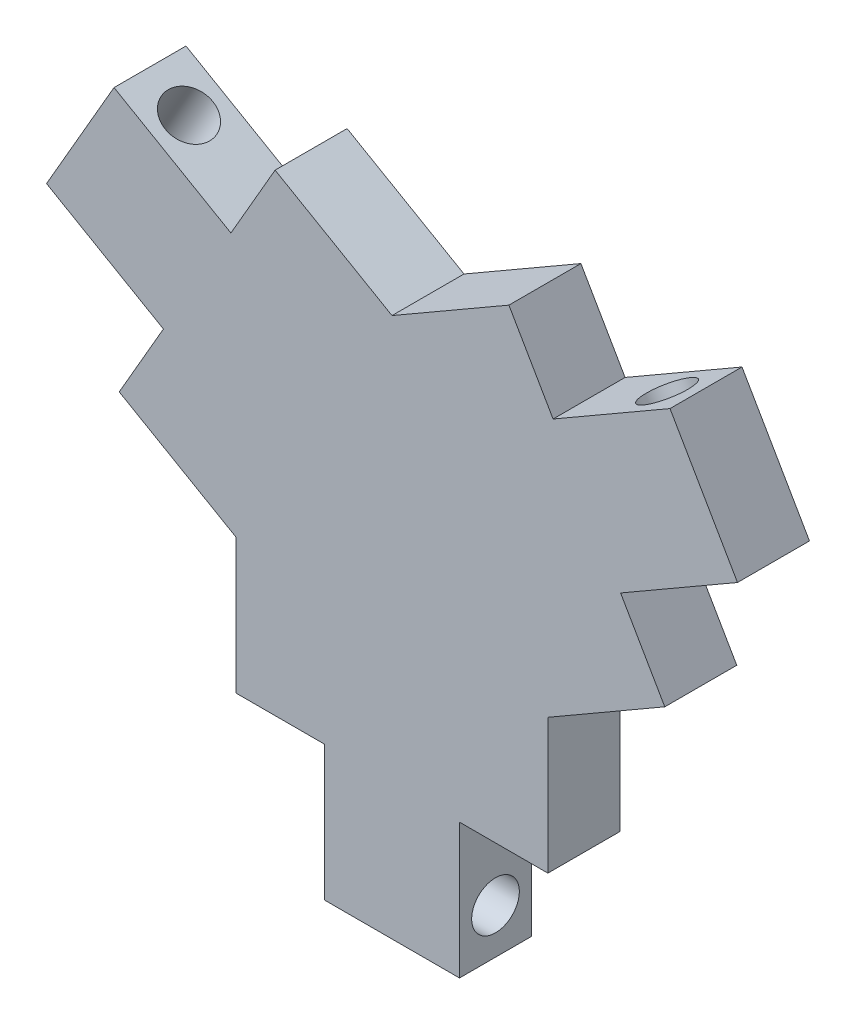
from build123d import *

# Parameters (mm, degrees)
BOSS_EXTRUDE5_DEPTH = 8
CUT_EXTRUDE4_REACH  = 91.241
SKETCH6_R           = 2.65
CUT_EXTRUDE5_REACH  = 89.972
SKETCH7_R           = 2.65
CUT_EXTRUDE6_REACH  = 74.553
SKETCH8_R           = 2.65
CUT_EXTRUDE7_REACH  = 91.241
SKETCH10_W          = 9.820508075
SKETCH10_H          = 15
SKETCH10_W_2        = 9.820508076


with BuildPart() as part:
    # Sketch1 → Boss-Extrude5 (new body)
    with BuildSketch(Plane(origin=(0, 0, 0), x_dir=(0, 1, 0), z_dir=(0, 0, 1))):
        Polygon((35, 60.621778265), (30, 51.961524227), (50, 17.320508076), (65, 43.301270189), align=None)
        Polygon((60, 0), (0, 0), (30, 51.961524227), align=None)
        Polygon((60, 0), (20, 0), (35, -25.980762114), (65, -8.660254038), align=None)
        Polygon((-10, 0), (0, 0), (20, 34.641016151), (-10, 34.641016151), align=None)
    extrude(amount=BOSS_EXTRUDE5_DEPTH)

    # Sketch6 → Cut-Extrude4 (cut, up to next)
    with BuildSketch(Plane(origin=(-34.641016151, 0, 0), x_dir=(0, -1, 0), z_dir=(-1, 0, 0)), mode=Mode.PRIVATE) as cut_extrude4_sk1:
        with Locations(Location((5, 4, 0), (0, 0, 90))):
            Circle(SKETCH6_R)
    cut_extrude4_tool1 = extrude(cut_extrude4_sk1.sketch, amount=-CUT_EXTRUDE4_REACH, mode=Mode.PRIVATE) & part.part
    add(cut_extrude4_tool1.solids().sort_by_distance((-34.641016, -5, 4))[0], mode=Mode.SUBTRACT)

    # Sketch7 → Cut-Extrude5 (cut, up to next)
    with BuildSketch(Plane(origin=(17.320508076, 30, 0), x_dir=(-0.8660254037844388, 0.49999999999999967, 0), z_dir=(0.49999999999999967, 0.8660254037844388, 0)), mode=Mode.PRIVATE) as cut_extrude5_sk1:
        with Locations((65, 4)):
            Circle(SKETCH7_R)
    cut_extrude5_tool1 = extrude(cut_extrude5_sk1.sketch, amount=-CUT_EXTRUDE5_REACH, mode=Mode.PRIVATE) & part.part
    add(cut_extrude5_tool1.solids().sort_by_distance((-38.971143, 62.5, 4))[0], mode=Mode.SUBTRACT)

    # Sketch8 → Cut-Extrude6 (cut, up to next)
    with BuildSketch(Plane(origin=(-8.660254038, 15, 0), x_dir=(0.8660254037844385, 0.5000000000000003, 0), z_dir=(0.5000000000000003, -0.8660254037844385, 0)), mode=Mode.PRIVATE) as cut_extrude6_sk1:
        with Locations((35, 4)):
            Circle(SKETCH8_R)
    cut_extrude6_tool1 = extrude(cut_extrude6_sk1.sketch, amount=-CUT_EXTRUDE6_REACH, mode=Mode.PRIVATE) & part.part
    add(cut_extrude6_tool1.solids().sort_by_distance((21.650635, 32.5, 4))[0], mode=Mode.SUBTRACT)

    # Sketch10 → Cut-Extrude7 (cut, up to next)
    with BuildSketch(Plane.XY.offset(8), mode=Mode.PRIVATE) as cut_extrude7_sk1:
        with Locations((-29.730762114, -2.5)):
            Rectangle(SKETCH10_W, SKETCH10_H)
    cut_extrude7_tool1 = extrude(cut_extrude7_sk1.sketch, amount=-CUT_EXTRUDE7_REACH, mode=Mode.PRIVATE) & part.part
    # Sketch10 → Cut-Extrude7 (cut, up to next)
    with BuildSketch(Plane.XY.offset(8), mode=Mode.PRIVATE) as cut_extrude7_sk2:
        with Locations((-4.910254038, -2.5)):
            Rectangle(SKETCH10_W_2, SKETCH10_H)
    cut_extrude7_tool2 = extrude(cut_extrude7_sk2.sketch, amount=-CUT_EXTRUDE7_REACH, mode=Mode.PRIVATE) & part.part
    # Sketch10 → Cut-Extrude7 (cut, up to next)
    with BuildSketch(Plane.XY.offset(8), mode=Mode.PRIVATE) as cut_extrude7_sk3:
        Polygon((-60.621778265, 35), (-55.711524227, 43.504809472), (-42.72114317, 36.004809472), (-47.631397208, 27.5), align=None)
    cut_extrude7_tool3 = extrude(cut_extrude7_sk3.sketch, amount=-CUT_EXTRUDE7_REACH, mode=Mode.PRIVATE) & part.part
    # Sketch10 → Cut-Extrude7 (cut, up to next)
    with BuildSketch(Plane.XY.offset(8), mode=Mode.PRIVATE) as cut_extrude7_sk4:
        Polygon((-43.301270189, 65), (-30.310889132, 57.5), (-35.22114317, 48.995190528), (-48.211524227, 56.495190528), align=None)
    cut_extrude7_tool4 = extrude(cut_extrude7_sk4.sketch, amount=-CUT_EXTRUDE7_REACH, mode=Mode.PRIVATE) & part.part
    # Sketch10 → Cut-Extrude7 (cut, up to next)
    with BuildSketch(Plane.XY.offset(8), mode=Mode.PRIVATE) as cut_extrude7_sk5:
        Polygon((8.660254038, 65), (13.570508076, 56.495190528), (0.580127019, 48.995190528), (-4.330127019, 57.5), align=None)
    cut_extrude7_tool5 = extrude(cut_extrude7_sk5.sketch, amount=-CUT_EXTRUDE7_REACH, mode=Mode.PRIVATE) & part.part
    # Sketch10 → Cut-Extrude7 (cut, up to next)
    with BuildSketch(Plane.XY.offset(8), mode=Mode.PRIVATE) as cut_extrude7_sk6:
        Polygon((25.980762114, 35), (12.990381057, 27.5), (8.080127019, 36.004809472), (21.070508076, 43.504809472), align=None)
    cut_extrude7_tool6 = extrude(cut_extrude7_sk6.sketch, amount=-CUT_EXTRUDE7_REACH, mode=Mode.PRIVATE) & part.part
    add(cut_extrude7_tool1.solids().sort_by_distance((-29.730762, -2.5, 8))[0], mode=Mode.SUBTRACT)
    add(cut_extrude7_tool2.solids().sort_by_distance((-4.910254, -2.5, 8))[0], mode=Mode.SUBTRACT)
    add(cut_extrude7_tool3.solids().sort_by_distance((-51.671461, 35.502405, 8))[0], mode=Mode.SUBTRACT)
    add(cut_extrude7_tool4.solids().sort_by_distance((-39.261207, 56.997595, 8))[0], mode=Mode.SUBTRACT)
    add(cut_extrude7_tool5.solids().sort_by_distance((4.620191, 56.997595, 8))[0], mode=Mode.SUBTRACT)
    add(cut_extrude7_tool6.solids().sort_by_distance((17.030445, 35.502405, 8))[0], mode=Mode.SUBTRACT)


solid = part.part
